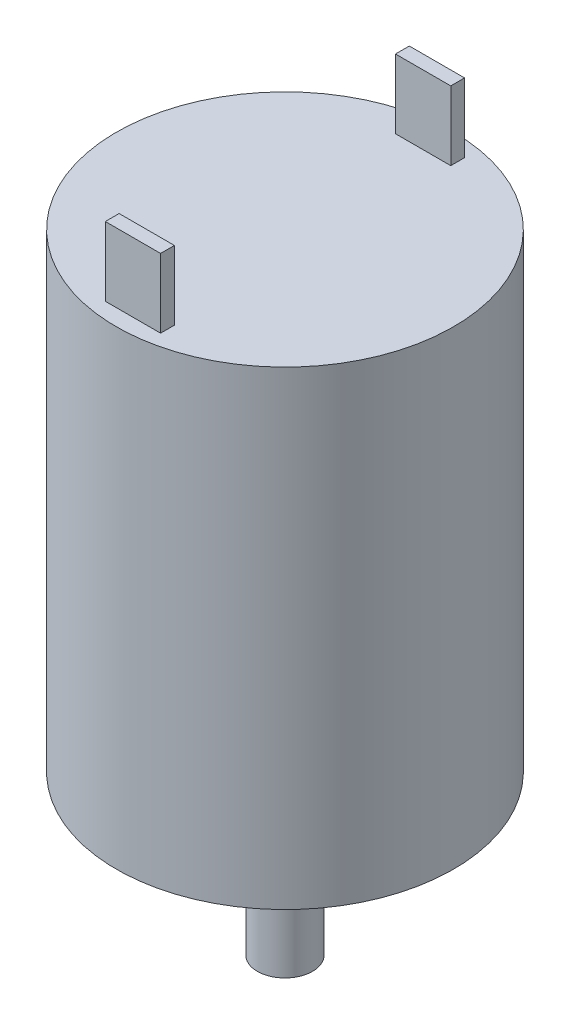
from build123d import *

# Parameters (mm, degrees)
SKETCH2_W           = 4
SKETCH2_H           = 1
BOSS_EXTRUDE1_DEPTH = 5


with BuildPart() as part:
    # Sketch1 → Revolve1 (revolve)
    with BuildSketch(Plane.XY, mode=Mode.PRIVATE) as revolve1_sk:
        Polygon((0, 0), (12.2, 0), (12.2, -34), (2, -34), (2, -45.5), (0, -45.5), align=None)
    revolve(revolve1_sk.sketch.rotate(Axis((0, -45.5, 0), (0, 1, 0)), 90), axis=Axis((0, -45.5, 0), (0, 1, 0)))

    # Sketch2 → Boss-Extrude1 (add)
    with BuildSketch(Plane(origin=(0, 0, 0), x_dir=(1, 0, 0), z_dir=(0, 1, 0))):
        with Locations((0, -10.5)):
            Rectangle(SKETCH2_W, SKETCH2_H)
        with Locations((0, 10.5)):
            Rectangle(SKETCH2_W, SKETCH2_H)
    extrude(amount=BOSS_EXTRUDE1_DEPTH)


solid = part.part
